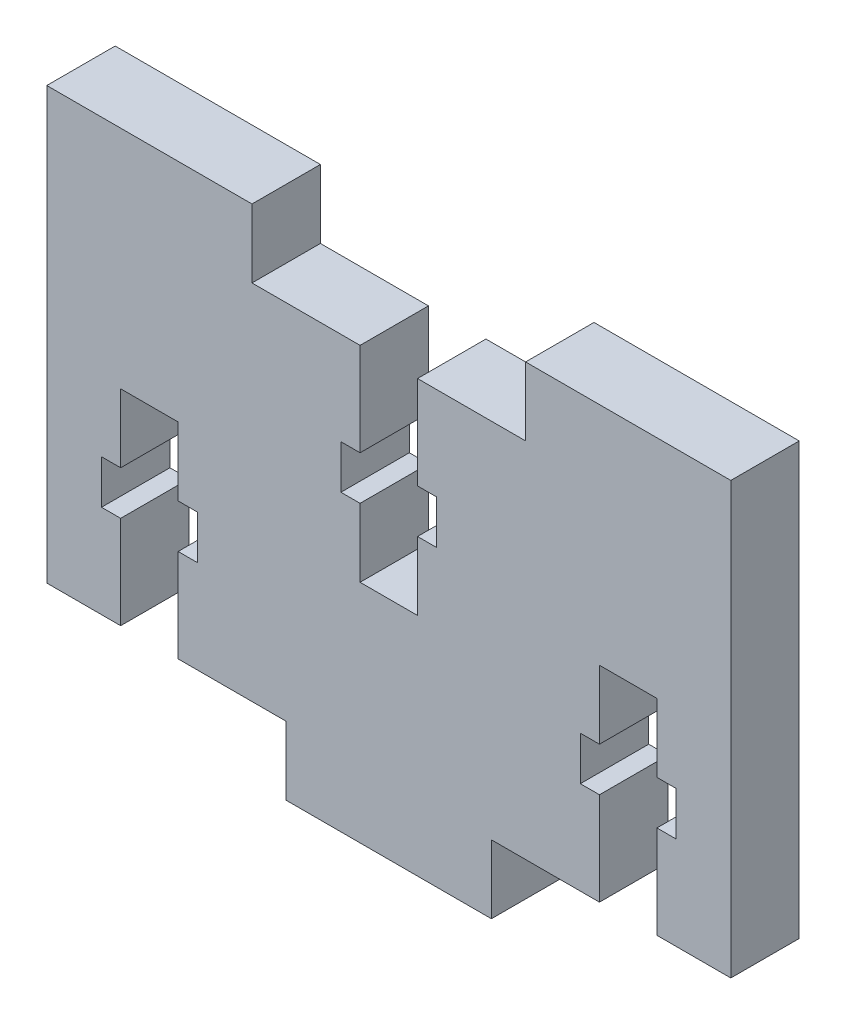
from build123d import *

# Parameters (mm, degrees)
BOSS_EXTRUDE1_DEPTH = 5


with BuildPart() as part:
    # Sketch1 → Boss-Extrude1 (new body)
    with BuildSketch(Plane.XY):
        Polygon((-5.4, 0), (0, 0), (0, 31.5), (-15, 31.5), (-15, 26.5), (-22.9, 26.5), (-22.9, 19.7), (-21.5, 19.7), (-21.5, 16.5), (-22.9, 16.5), (-22.9, 11.5), (-27.1, 11.5), (-27.1, 16.5), (-28.5, 16.5), (-28.5, 19.7), (-27.1, 19.7), (-27.1, 26.5), (-35, 26.5), (-35, 31.5), (-50, 31.5), (-50, 0), (-44.6, 0), (-44.6, 6.8), (-46, 6.8), (-46, 10), (-44.6, 10), (-44.6, 15), (-40.4, 15), (-40.4, 10), (-39, 10), (-39, 6.8), (-40.4, 6.8), (-40.4, 0), (-32.5, 0), (-32.5, -5), (-17.5, -5), (-17.5, 0), (-9.6, 0), (-9.6, 6.8), (-11, 6.8), (-11, 10), (-9.6, 10), (-9.6, 15), (-5.4, 15), (-5.4, 10), (-4, 10), (-4, 6.8), (-5.4, 6.8), align=None)
    extrude(amount=BOSS_EXTRUDE1_DEPTH)


solid = part.part
